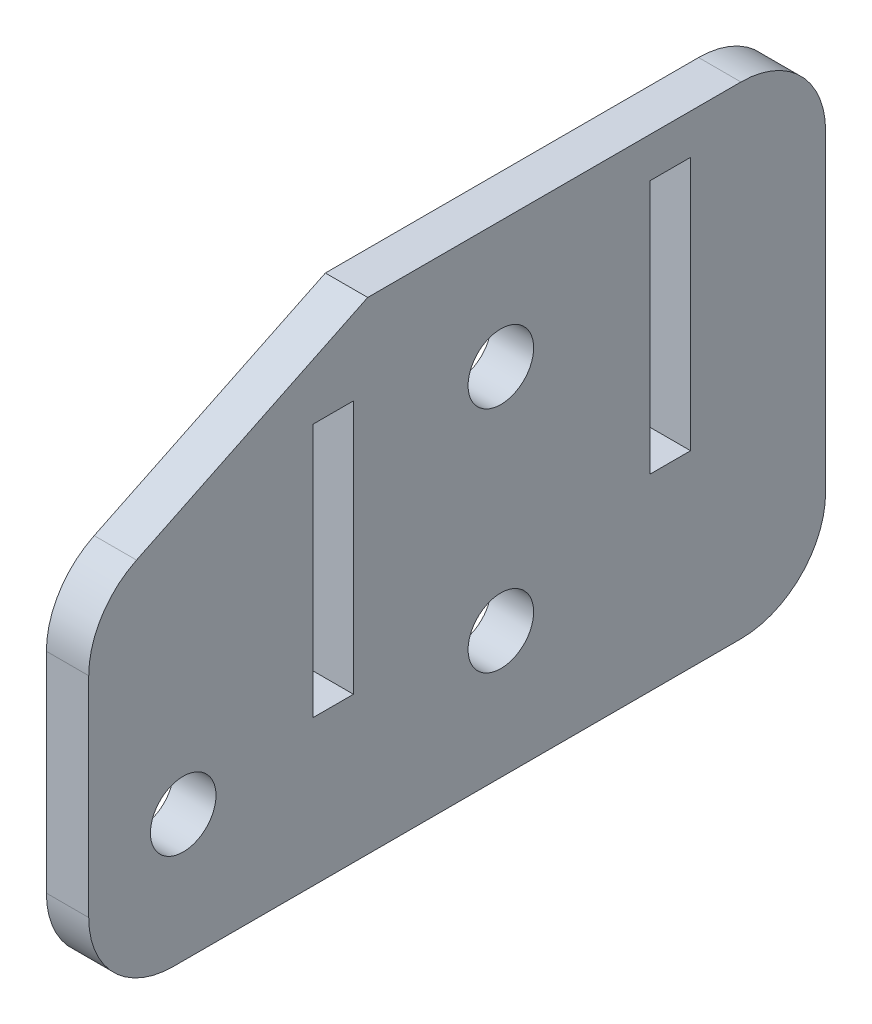
from build123d import *

# Parameters (mm, degrees)
BOSS_EXTRUDE1_DEPTH              = 3.175
SKETCH7_W                        = 3.048
SKETCH7_H                        = 19.05
CUT_EXTRUDE1_DEPTH               = 3.175
FILLET1_R                        = 6.35
F_10_0_1935_DIAMETER_HOLE2_D     = 4.9149
F_10_0_1935_DIAMETER_HOLE2_DEPTH = 9.699415072
F_10_0_1935_DIAMETER_HOLE2_TIP   = 1.476584928


with BuildPart() as part:
    # Sketch1 → Boss-Extrude1 (new body)
    with BuildSketch(Plane(origin=(0, 0, 0), x_dir=(0, 0, -1), z_dir=(1, 0, 0))):
        Polygon((55.245, 0), (55.245, 36.15436), (20.9147283, 36.15436), (0, 26.034021846), (0, 0), align=None)
    extrude(amount=BOSS_EXTRUDE1_DEPTH)

    # Sketch7 → Cut-Extrude1 (cut)
    with BuildSketch(Plane.ZY):
        with Locations((-43.596153092, 23.625208274)):
            Rectangle(SKETCH7_W, SKETCH7_H)
        with Locations((-18.323153092, 20.450208274)):
            Rectangle(SKETCH7_W, SKETCH7_H)
    extrude(amount=-CUT_EXTRUDE1_DEPTH, mode=Mode.SUBTRACT)

    # Fillet1
    fillet1_edges = [part.edges().sort_by_distance(p)[0] for p in [
        (1.5875, 0, 0),
        (1.5875, 26.034021846, 0),
        (1.5875, 36.15436, -55.245),
        (1.5875, 0, -55.245),
    ]]
    fillet(fillet1_edges, radius=FILLET1_R)

    # #10 (0.1935) Diameter Hole2
    with Locations(Plane.ZY):
        with Locations((-30.896153092, 9.525), (-30.896153092, 26.67), (-7.083653092, 9.525)):
            Hole(F_10_0_1935_DIAMETER_HOLE2_D / 2, depth=F_10_0_1935_DIAMETER_HOLE2_DEPTH)
            with Locations((0, 0, -(F_10_0_1935_DIAMETER_HOLE2_DEPTH + F_10_0_1935_DIAMETER_HOLE2_TIP / 2))):  # 118° drill point
                Cone(0, F_10_0_1935_DIAMETER_HOLE2_D / 2, F_10_0_1935_DIAMETER_HOLE2_TIP, mode=Mode.SUBTRACT)


solid = part.part
